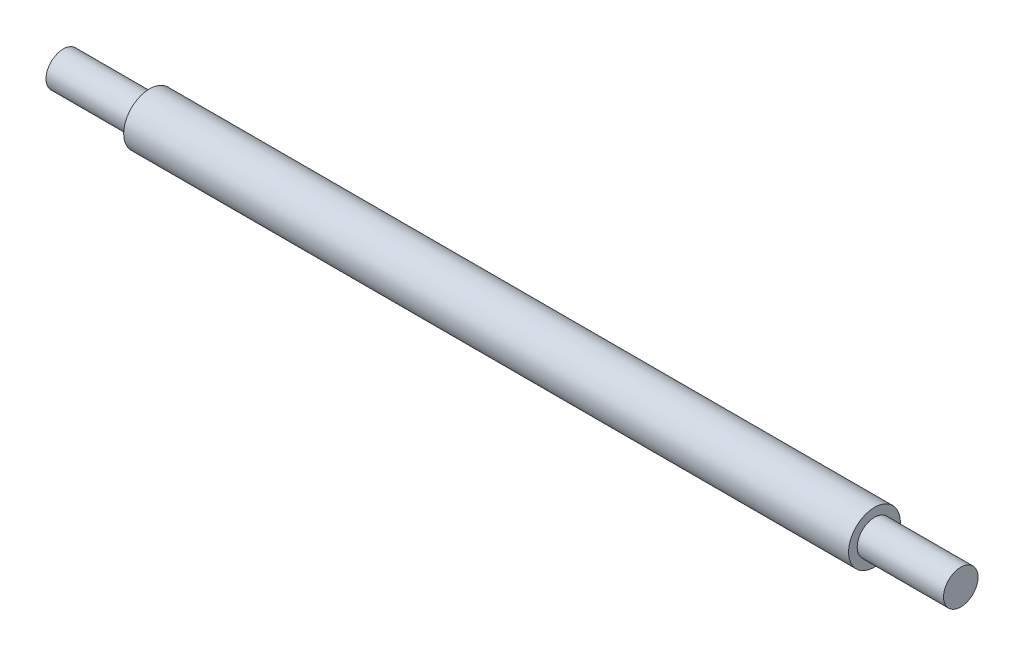
from build123d import *


with BuildPart() as part:
    # Sketch1 → Revolve1 (revolve)
    with BuildSketch(Plane.XY, mode=Mode.PRIVATE) as revolve1_sk:
        Polygon((0, 0), (104, 0), (104, 2), (94, 2), (94, 3), (10, 3), (10, 2), (0, 2), align=None)
    revolve(revolve1_sk.sketch.rotate(Axis((0, 0, 0), (1, 0, 0)), 90), axis=Axis((0, 0, 0), (1, 0, 0)))


solid = part.part
